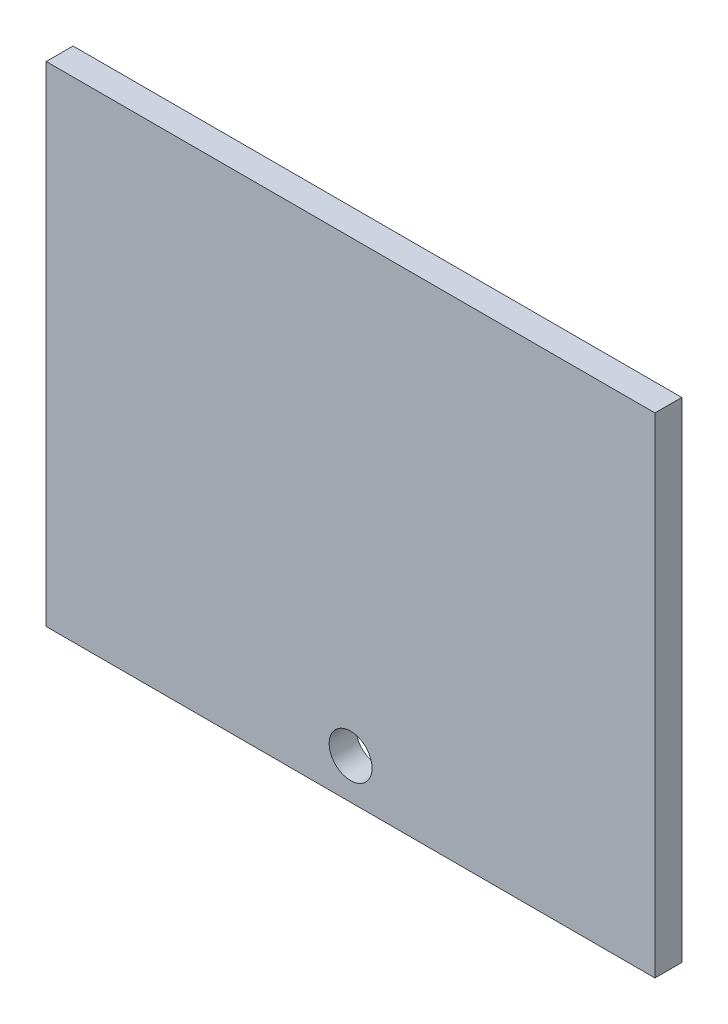
from build123d import *

# Parameters (mm, degrees)
SKETCH_1_W          = 45.4
SKETCH_1_H          = 36.5
EXTRUDE_1_DEPTH     = 2
SKETCH_10_R         = 1.6
CUT_EXTRUDE_9_DEPTH = 85.579435184
SKETCH_10_3_R       = 2.95
EXTRUDE_3_DEPTH     = 1.7


with BuildPart() as part:
    # 草图1 → 凸台-拉伸1 (new body)
    with BuildSketch(Plane.XY):
        with Locations((-49.741035857, 25.361663348)):
            Rectangle(SKETCH_1_W, SKETCH_1_H)
    extrude(amount=EXTRUDE_1_DEPTH)

    # 草图10 → 切除-拉伸9 (cut, through all)
    with BuildSketch(Plane(origin=(0, 0, 0), x_dir=(-1, 0, 0), z_dir=(0, 0, -1))):
        with Locations((49.741035857, 10.111663348)):
            Circle(SKETCH_10_R)
    extrude(amount=-CUT_EXTRUDE_9_DEPTH, mode=Mode.SUBTRACT)

    # 草图10<3> → 凸台-拉伸3 (add)
    with BuildSketch(Plane(origin=(0, 0, 0), x_dir=(-1, 0, 0), z_dir=(0, 0, -1))):
        with Locations((39.741035857, 20.111663348)):
            Circle(SKETCH_10_3_R)
        with Locations((59.741035857, 20.111663348)):
            Circle(SKETCH_10_3_R)
    extrude(amount=EXTRUDE_3_DEPTH)


solid = part.part
